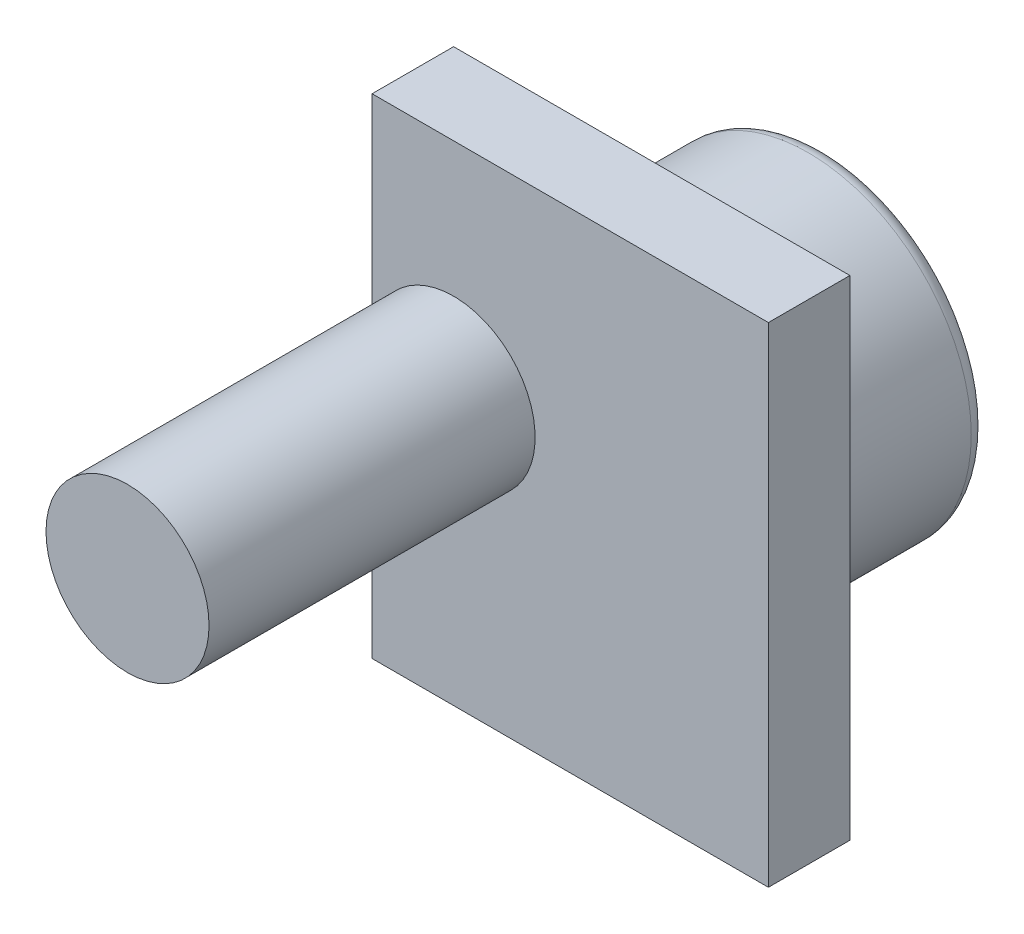
from build123d import *

# Parameters (mm, degrees)
SKIZZE2_R                       = 4
AUFSATZ_LINEAR_AUSTRAGEN1_DEPTH = 4
SKIZZE3_W                       = 9.723167254
SKIZZE3_H                       = 12
AUFSATZ_LINEAR_AUSTRAGEN2_DEPTH = 2
VERRUNDUNG1_R                   = 0.4
SKIZZE5_R                       = 2
AUFSATZ_LINEAR_AUSTRAGEN4_DEPTH = 8
SKIZZE4_R                       = 2.5
SCHNITT_LINEAR_AUSTRAGEN1_DEPTH = 0.4
SKIZZE4_5_R                     = 2.5
AUFSATZ_LINEAR_AUSTRAGEN5_DEPTH = 0.4


with BuildPart() as part:
    # Skizze2 → Aufsatz-Linear austragen1 (new body)
    with BuildSketch(Plane.XY):
        with Locations((-80.86767695, -8.439487313)):
            Circle(SKIZZE2_R)
    extrude(amount=-AUFSATZ_LINEAR_AUSTRAGEN1_DEPTH)

    # Skizze3 → Aufsatz-Linear austragen2 (add)
    with BuildSketch(Plane.XY):
        with Locations((-81.106093323, -8.939487313)):
            Rectangle(SKIZZE3_W, SKIZZE3_H)
    extrude(amount=AUFSATZ_LINEAR_AUSTRAGEN2_DEPTH)

    # Verrundung1
    verrundung1_edges = [part.edges().sort_by_distance(p)[0] for p in [
        (-84.86767695, -8.439487313, -4),
    ]]
    fillet(verrundung1_edges, radius=VERRUNDUNG1_R)

    # Skizze5 → Aufsatz-Linear austragen4 (add)
    with BuildSketch(Plane.XY.offset(2)):
        with Locations((-83.96767695, -8.239487313)):
            Circle(SKIZZE5_R)
    extrude(amount=AUFSATZ_LINEAR_AUSTRAGEN4_DEPTH)

    # Skizze4 → Schnitt-Linear austragen1 (cut)
    with BuildSketch(Plane(origin=(0, 0, -4), x_dir=(-1, 0, 0), z_dir=(0, 0, -1))):
        with Locations((80.86767695, -8.439487313)):
            Circle(SKIZZE4_R)
    extrude(amount=-SCHNITT_LINEAR_AUSTRAGEN1_DEPTH, mode=Mode.SUBTRACT)


with BuildPart() as body_2:
    # Skizze4<5> → Aufsatz-Linear austragen5 (new body)
    with BuildSketch(Plane(origin=(0, 0, -4), x_dir=(-1, 0, 0), z_dir=(0, 0, -1))):
        with Locations((80.86767695, -8.439487313)):
            Circle(SKIZZE4_5_R)
    extrude(amount=-AUFSATZ_LINEAR_AUSTRAGEN5_DEPTH)


solid = Compound([part.part, body_2.part])
